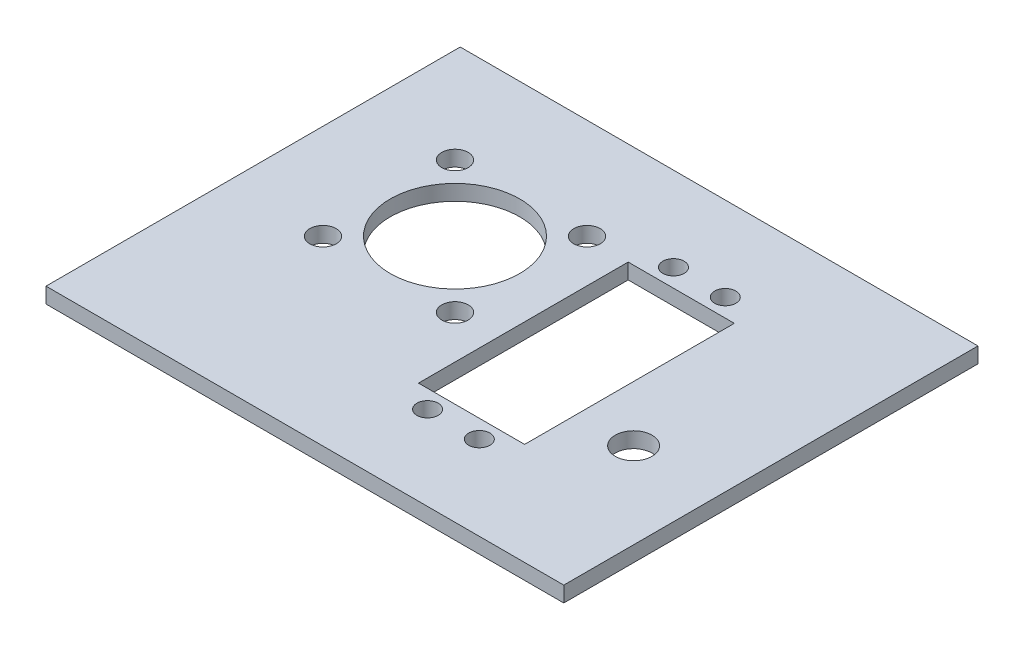
from build123d import *

# Parameters (mm, degrees)
SZKIC1_W                    = 100
SZKIC1_H                    = 80
SZKIC1_R                    = 3.55
SZKIC1_R_2                  = 2.05
SZKIC1_R_3                  = 2.55
SZKIC1_R_4                  = 12.5
SZKIC1_W_2                  = 20.5
SZKIC1_H_2                  = 40.5
DODANIE_WYCI_GNI_CIE1_DEPTH = 3


with BuildPart() as part:
    # Szkic1 → Dodanie-wyciągnięcie1 (new body)
    with BuildSketch(Plane(origin=(0, 0, 0), x_dir=(1, 0, 0), z_dir=(0, 1, 0))):
        with Locations((11.336719097, -8.838965942)):
            Rectangle(SZKIC1_W, SZKIC1_H)
        with Locations(Location((44.775116298, -18.788965942, 0), (0, 0, 270))):
            Circle(SZKIC1_R, mode=Mode.SUBTRACT)
        with Locations(Location((28.775116298, -32.588965942, 0), (0, 0, 270))):
            Circle(SZKIC1_R_2, mode=Mode.SUBTRACT)
        with Locations(Location((18.775116298, -32.588965942, 0), (0, 0, 270))):
            Circle(SZKIC1_R_2, mode=Mode.SUBTRACT)
        with Locations(Location((28.775116298, 14.911034058, 0), (0, 0, 270))):
            Circle(SZKIC1_R_2, mode=Mode.SUBTRACT)
        with Locations(Location((18.775116298, 14.911034058, 0), (0, 0, 270))):
            Circle(SZKIC1_R_2, mode=Mode.SUBTRACT)
        with Locations(Location((-20.268770099, -13.743104788, 0), (0, 0, 270))):
            Circle(SZKIC1_R_3, mode=Mode.SUBTRACT)
        with Locations(Location((5.231229901, -13.743104788, 0), (0, 0, 270))):
            Circle(SZKIC1_R_3, mode=Mode.SUBTRACT)
        with Locations(Location((5.231229901, 11.756895212, 0), (0, 0, 270))):
            Circle(SZKIC1_R_3, mode=Mode.SUBTRACT)
        with Locations(Location((-20.268770099, 11.756895212, 0), (0, 0, 270))):
            Circle(SZKIC1_R_3, mode=Mode.SUBTRACT)
        with Locations(Location((-7.518770099, -0.993104788, 0), (0, 0, 270))):
            Circle(SZKIC1_R_4, mode=Mode.SUBTRACT)
        with Locations((23.775116298, -8.838965942)):
            Rectangle(SZKIC1_W_2, SZKIC1_H_2, mode=Mode.SUBTRACT)
    extrude(amount=DODANIE_WYCI_GNI_CIE1_DEPTH)


solid = part.part
